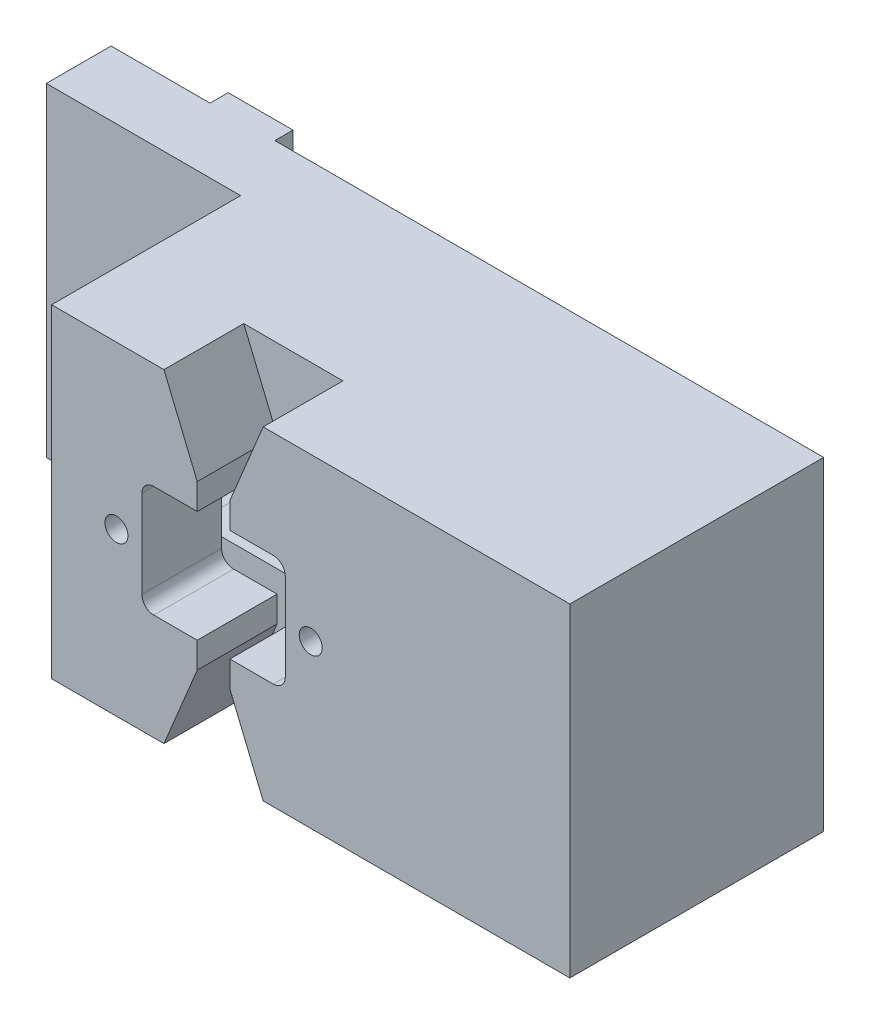
from build123d import *

# Parameters (mm, degrees)
SKETCH1_W               = 69.85
SKETCH1_H               = 31.75
BOSS_EXTRUDE1_DEPTH     = 24.88
CUT_EXTRUDE1_DEPTH      = 17.06
CUT_EXTRUDE2_DEPTH      = 7.82
CUT_EXTRUDE3_DEPTH      = 7.82
F_4_40_TAPPED_HOLE1_D   = 2.2606
SKETCH7_W               = 6.35
SKETCH7_H               = 31.75
BOSS_EXTRUDE2_DEPTH     = 1.778
SKETCH8_W               = 19.05
SKETCH8_H               = 18.53
CUT_EXTRUDE4_DEPTH      = 81.660395486
F_1_4_CLEARANCE_HOLE1_D = 7.14248


with BuildPart() as part:
    # Sketch1 → Boss-Extrude1 (new body)
    with BuildSketch(Plane.XY):
        with Locations((34.925, 15.875)):
            Rectangle(SKETCH1_W, SKETCH1_H)
    extrude(amount=BOSS_EXTRUDE1_DEPTH)

    # Sketch2 → Cut-Extrude1 (cut)
    with BuildSketch(Plane(origin=(0, 0, 0), x_dir=(-1, 0, 0), z_dir=(0, 0, -1))):
        with BuildLine():
            Line((-68.2625, 25.8953), (-50.8, 25.8953))
            Line((-50.8, 25.8953), (-50.8, 19.177))
            Line((-50.8, 19.177), (-25.4, 19.177))
            ThreePointArc((-25.4, 19.177), (-22.098, 15.875), (-25.4, 12.573))
            Line((-25.4, 12.573), (-50.8, 12.573))
            Line((-50.8, 12.573), (-50.8, 5.8547))
            Line((-50.8, 5.8547), (-68.2625, 5.8547))
            Line((-68.2625, 5.8547), (-68.2625, 25.8953))
        make_face()
    extrude(amount=-CUT_EXTRUDE1_DEPTH, mode=Mode.SUBTRACT)

    # Sketch3 → Cut-Extrude2 (cut)
    with BuildSketch(Plane.XY.offset(24.88)):
        with BuildLine():
            Line((29.068797257, 21.336), (40.781202743, 21.336))
            ThreePointArc((40.781202743, 21.336), (41.611202743, 20.992202743), (41.955, 20.162202743))
            Line((41.955, 20.162202743), (41.955, 11.587797257))
            ThreePointArc((41.955, 11.587797257), (41.611202743, 10.757797257), (40.781202743, 10.414))
            Line((40.781202743, 10.414), (29.068797257, 10.414))
            ThreePointArc((29.068797257, 10.414), (28.238797257, 10.757797257), (27.895, 11.587797257))
            Line((27.895, 11.587797257), (27.895, 20.162202743))
            ThreePointArc((27.895, 20.162202743), (28.238797257, 20.992202743), (29.068797257, 21.336))
        make_face()
    extrude(amount=-CUT_EXTRUDE2_DEPTH, mode=Mode.SUBTRACT)

    # Sketch4 → Cut-Extrude3 (cut)
    with BuildSketch(Plane.XY.offset(24.88)):
        Polygon((30.06348241, 31.75), (33.325, 23.876), (33.325, 21.336), (36.525, 21.336), (36.525, 23.876), (39.78651759, 31.75), align=None)
        Polygon((33.325, 10.414), (33.325, 7.874), (30.06348241, 0), (39.78651759, 0), (36.525, 7.874), (36.525, 10.414), align=None)
    extrude(amount=-CUT_EXTRUDE3_DEPTH, mode=Mode.SUBTRACT)

    # #4-40 Tapped Hole1 (through all)
    with Locations(Plane(origin=(0, 0, 17.06), x_dir=(-1, 0, 0), z_dir=(0, 0, -1))):
        with Locations((-44.45, 15.875), (-25.4, 15.875)):
            Hole(F_4_40_TAPPED_HOLE1_D / 2)

    # Sketch7 → Boss-Extrude2 (add)
    with BuildSketch(Plane(origin=(0, 0, 0), x_dir=(-1, 0, 0), z_dir=(0, 0, -1))):
        with Locations((-12.876533699, 15.875)):
            Rectangle(SKETCH7_W, SKETCH7_H)
    extrude(amount=BOSS_EXTRUDE2_DEPTH)

    # Sketch8 → Cut-Extrude4 (cut, through all)
    with BuildSketch(Plane(origin=(0, 31.75, 0), x_dir=(1, 0, 0), z_dir=(0, 1, 0))):
        with Locations((9.525, -15.615)):
            Rectangle(SKETCH8_W, SKETCH8_H)
    extrude(amount=-CUT_EXTRUDE4_DEPTH, mode=Mode.SUBTRACT)

    # 1/4 Clearance Hole1 (through all)
    with Locations(Plane.XY.offset(6.35)):
        with Locations((12.876533699, 15.875)):
            Hole(F_1_4_CLEARANCE_HOLE1_D / 2)


solid = part.part
